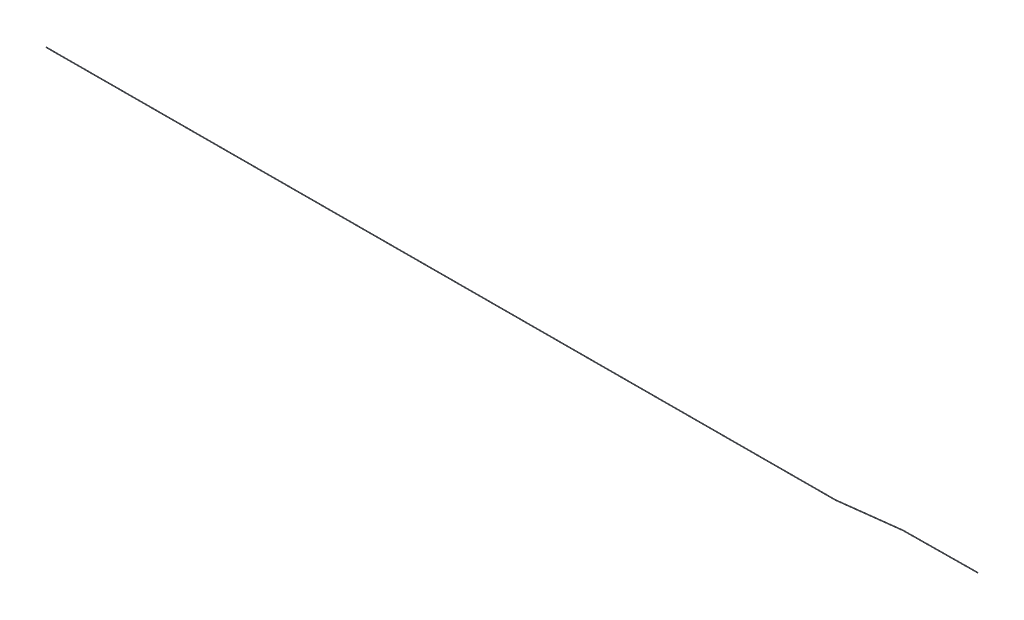
from build123d import *

# Parameters (mm, degrees)
SWEEP2_PROFILE_R = 0.225


with BuildPart() as part:
    # Sweep2: sweep along a curve in space
    with BuildLine() as sweep2_path:
        Line((-389.062465524, -1.164409573, 3.363484066), (275.83746977, 0.816026872, 3.163574011))
        Line((326.354616488, 0.853605036, -3.065331484), (275.83746977, 0.816026872, 3.163574011))
        Line((326.354616488, 0.853605036, -3.065331484), (389.062465524, 1.164409573, -3.363484066))
    # Sweep2 profile (on start of the path) → Sweep2 (sweep)
    with BuildSketch(Plane(origin=(-389.062465524, -1.164409573, 3.363484066), x_dir=(-0.002978534896180895, 0.9999955641550978, 0), z_dir=(0.9999955189569237, 0.0029785347615559586, -0.0003006605179920666))):
        Circle(SWEEP2_PROFILE_R)
    sweep(path=sweep2_path.line, transition=Transition.RIGHT)


solid = part.part
